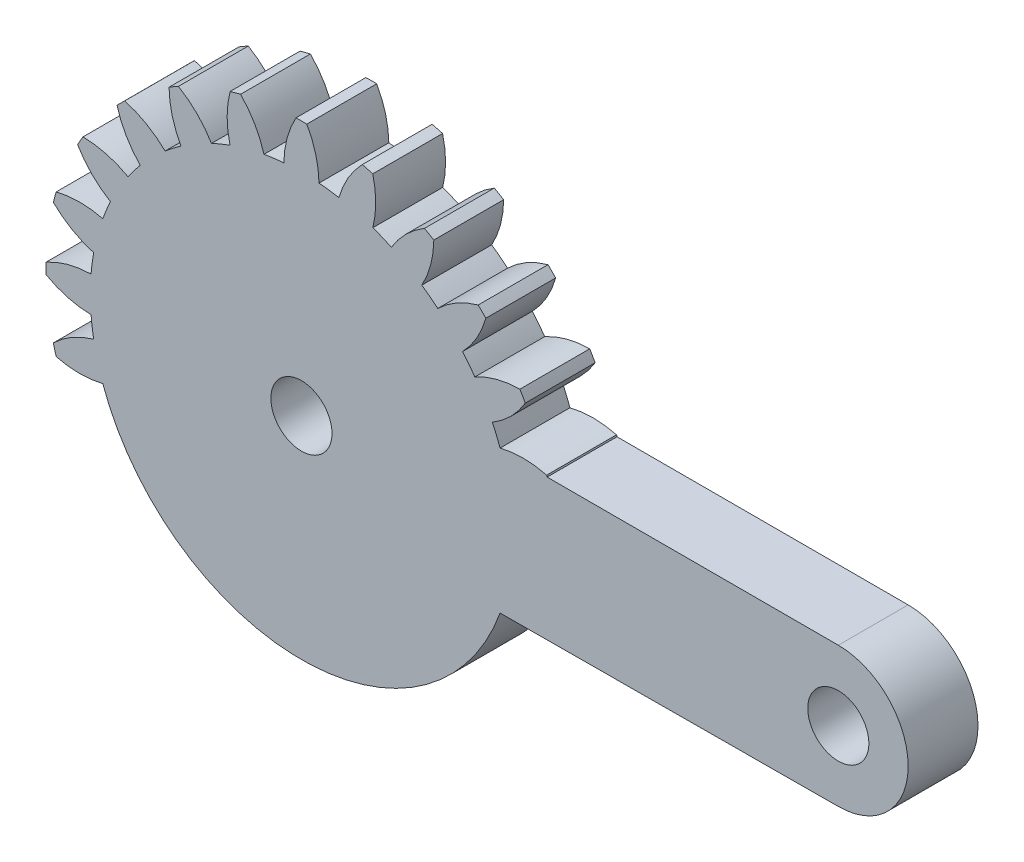
from build123d import *

# Parameters (mm, degrees)
SKETCH1_R           = 1.75
BOSS_EXTRUDE2_DEPTH = 4
SKETCH2_R           = 1.75
CUT_EXTRUDE1_DEPTH  = 38.915688046
SCALE1_SCALE_X      = 1.5
SCALE1_SCALE_Y      = 1.5
SCALE1_SCALE_Z      = 1.5


with BuildPart() as part:
    # Sketch1 → Boss-Extrude2 (new body)
    with BuildSketch(Plane.XY):
        with BuildLine():
            ThreePointArc((30.768609945, -3.999956709), (34.749989177, 0.009304998), (30.75, 4))
            Line((30.75, 4), (14.072558403, 4))
            ThreePointArc((14.072558403, 4), (14.06038767, 4.04257326), (14.048088143, 4.085109489))
            ThreePointArc((14.048088143, 4.085109489), (12.712915648, 4.255390909), (11.377106712, 4.090176385))
            ThreePointArc((11.377106712, 4.090176385), (11.169703548, 4.626642697), (10.937020765, 5.152637848))
            ThreePointArc((10.937020765, 5.152637848), (11.998404632, 5.980373095), (12.82210701, 7.044889767))
            ThreePointArc((12.82210701, 7.044889767), (12.669951657, 7.315), (12.51210701, 7.581825517))
            ThreePointArc((12.51210701, 7.581825517), (11.17835734, 7.400736668), (9.930825655, 6.8954189))
            ThreePointArc((9.930825655, 6.8954189), (9.591641884, 7.359925677), (9.230750012, 7.807775241))
            ThreePointArc((9.230750012, 7.807775241), (10.041734454, 8.882012453), (10.561852666, 10.123446462))
            ThreePointArc((10.561852666, 10.123446462), (10.344972209, 10.344972209), (10.123446462, 10.561852666))
            ThreePointArc((10.123446462, 10.561852666), (8.882012453, 10.041734454), (7.807775241, 9.230750012))
            ThreePointArc((7.807775241, 9.230750012), (7.359925677, 9.591641884), (6.8954189, 9.930825655))
            ThreePointArc((6.8954189, 9.930825655), (7.400736668, 11.17835734), (7.581825517, 12.51210701))
            ThreePointArc((7.581825517, 12.51210701), (7.315, 12.669951657), (7.044889767, 12.82210701))
            ThreePointArc((7.044889767, 12.82210701), (5.980373095, 11.998404632), (5.152637848, 10.937020765))
            ThreePointArc((5.152637848, 10.937020765), (4.626642697, 11.169703548), (4.090176385, 11.377106712))
            ThreePointArc((4.090176385, 11.377106712), (4.255390909, 12.712915648), (4.085109489, 14.048088143))
            ThreePointArc((4.085109489, 14.048088143), (3.78652263, 14.131494839), (3.486235477, 14.208555951))
            ThreePointArc((3.486235477, 14.208555951), (2.671181194, 13.137403362), (2.1463567, 11.897951627))
            ThreePointArc((2.1463567, 11.897951627), (1.578061664, 11.986568374), (1.00619511, 12.048056748))
            ThreePointArc((1.00619511, 12.048056748), (0.820047291, 13.381109763), (0.31, 14.626715284))
            ThreePointArc((0.31, 14.626715284), (0, 14.63), (-0.31, 14.626715284))
            ThreePointArc((-0.31, 14.626715284), (-0.820047291, 13.381109763), (-1.00619511, 12.048056748))
            ThreePointArc((-1.00619511, 12.048056748), (-1.578061664, 11.986568374), (-2.1463567, 11.897951627))
            ThreePointArc((-2.1463567, 11.897951627), (-2.671181194, 13.137403362), (-3.486235477, 14.208555951))
            ThreePointArc((-3.486235477, 14.208555951), (-3.78652263, 14.131494839), (-4.085109489, 14.048088143))
            ThreePointArc((-4.085109489, 14.048088143), (-4.255390909, 12.712915648), (-4.090176385, 11.377106712))
            ThreePointArc((-4.090176385, 11.377106712), (-4.626642697, 11.169703548), (-5.152637848, 10.937020765))
            ThreePointArc((-5.152637848, 10.937020765), (-5.980373095, 11.998404632), (-7.044889767, 12.82210701))
            ThreePointArc((-7.044889767, 12.82210701), (-7.315, 12.669951657), (-7.581825517, 12.51210701))
            ThreePointArc((-7.581825517, 12.51210701), (-7.400736668, 11.17835734), (-6.8954189, 9.930825655))
            ThreePointArc((-6.8954189, 9.930825655), (-7.359925677, 9.591641884), (-7.807775241, 9.230750012))
            ThreePointArc((-7.807775241, 9.230750012), (-8.882012453, 10.041734454), (-10.123446462, 10.561852666))
            ThreePointArc((-10.123446462, 10.561852666), (-10.344972209, 10.344972209), (-10.561852666, 10.123446462))
            ThreePointArc((-10.561852666, 10.123446462), (-10.041734454, 8.882012453), (-9.230750012, 7.807775241))
            ThreePointArc((-9.230750012, 7.807775241), (-9.591641884, 7.359925677), (-9.930825655, 6.8954189))
            ThreePointArc((-9.930825655, 6.8954189), (-11.17835734, 7.400736668), (-12.51210701, 7.581825517))
            ThreePointArc((-12.51210701, 7.581825517), (-12.669951657, 7.315), (-12.82210701, 7.044889767))
            ThreePointArc((-12.82210701, 7.044889767), (-11.998404632, 5.980373095), (-10.937020765, 5.152637848))
            ThreePointArc((-10.937020765, 5.152637848), (-11.169703548, 4.626642697), (-11.377106712, 4.090176385))
            ThreePointArc((-11.377106712, 4.090176385), (-12.712915648, 4.255390909), (-14.048088143, 4.085109489))
            ThreePointArc((-14.048088143, 4.085109489), (-14.131494839, 3.78652263), (-14.208555951, 3.486235477))
            ThreePointArc((-14.208555951, 3.486235477), (-13.137403362, 2.671181194), (-11.897951627, 2.1463567))
            ThreePointArc((-11.897951627, 2.1463567), (-11.986568374, 1.578061664), (-12.048056748, 1.00619511))
            ThreePointArc((-12.048056748, 1.00619511), (-13.381109763, 0.820047291), (-14.626715284, 0.31))
            ThreePointArc((-14.626715284, 0.31), (-14.63, 0), (-14.626715284, -0.31))
            ThreePointArc((-14.626715284, -0.31), (-13.381109763, -0.820047291), (-12.048056748, -1.00619511))
            ThreePointArc((-12.048056748, -1.00619511), (-11.986568374, -1.578061664), (-11.897951627, -2.1463567))
            ThreePointArc((-11.897951627, -2.1463567), (-13.137403362, -2.671181194), (-14.208555951, -3.486235477))
            ThreePointArc((-14.208555951, -3.486235477), (-14.131494839, -3.78652263), (-14.048088143, -4.085109489))
            ThreePointArc((-14.048088143, -4.085109489), (-12.712915648, -4.255390909), (-11.377106712, -4.090176385))
            ThreePointArc((-11.377106712, -4.090176385), (0, -12.09), (11.377106712, -4.090176385))
            Line((11.377106712, -4.090176385), (30.768609945, -3.999956709))
        make_face()
        with Locations((30.75, 0)):
            Circle(SKETCH1_R, mode=Mode.SUBTRACT)
    extrude(amount=BOSS_EXTRUDE2_DEPTH)

    # Sketch2 → Cut-Extrude1 (cut, through all)
    with BuildSketch(Plane.XY.offset(4)):
        Circle(SKETCH2_R)
    extrude(amount=-CUT_EXTRUDE1_DEPTH, mode=Mode.SUBTRACT)


with BuildPart() as part_1:
    # Scale1: scaled about (5.428326269, 0.549917318, 2)
    add(part.part.scale((SCALE1_SCALE_X, SCALE1_SCALE_Y, SCALE1_SCALE_Z), about=(5.428326269, 0.549917318, 2)))


solid = part_1.part
